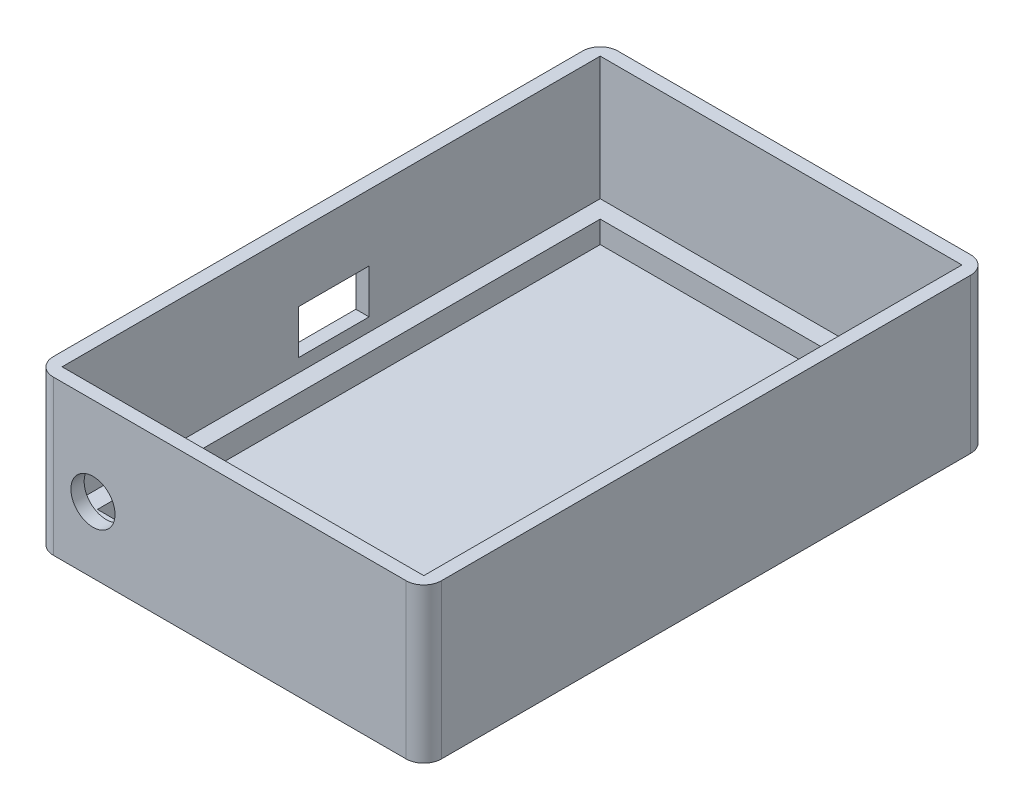
from build123d import *

# Parameters (mm, degrees)
SKETCH1_W           = 44
SKETCH1_H           = 64
SKETCH1_W_2         = 40
SKETCH1_H_2         = 60
SKETCH1_W_3         = 37
SKETCH1_H_3         = 57
BOSS_EXTRUDE1_DEPTH = 2.5
SKETCH2_W           = 44
SKETCH2_H           = 64
SKETCH2_W_2         = 41
SKETCH2_H_2         = 61
BOSS_EXTRUDE2_DEPTH = 14
SKETCH3_W           = 44
SKETCH3_H           = 64
BOSS_EXTRUDE3_DEPTH = 1
SKETCH4_W           = 8
SKETCH4_H           = 5
CUT_EXTRUDE1_DEPTH  = 8
SKETCH5_R           = 2.5
CUT_EXTRUDE2_DEPTH  = 8
FILLET1_R           = 2


with BuildPart() as part:
    # Sketch1 → Boss-Extrude1 (new body)
    # profile 1 of 2: a face of its own
    with BuildSketch(Plane(origin=(0, 0, 0), x_dir=(1, 0, 0), z_dir=(0, 1, 0))):
        Rectangle(SKETCH1_W, SKETCH1_H)
        Rectangle(SKETCH1_W_2, SKETCH1_H_2, mode=Mode.SUBTRACT)
    # profile 2 of 2: a face of its own
    with BuildSketch(Plane(origin=(0, 0, 0), x_dir=(1, 0, 0), z_dir=(0, 1, 0))):
        Rectangle(SKETCH1_W_2, SKETCH1_H_2)
        Rectangle(SKETCH1_W_3, SKETCH1_H_3, mode=Mode.SUBTRACT)
    extrude(amount=-BOSS_EXTRUDE1_DEPTH)

    # Sketch2 → Boss-Extrude2 (add)
    with BuildSketch(Plane(origin=(0, 0, 0), x_dir=(1, 0, 0), z_dir=(0, 1, 0))):
        Rectangle(SKETCH2_W, SKETCH2_H)
        Rectangle(SKETCH2_W_2, SKETCH2_H_2, mode=Mode.SUBTRACT)
    extrude(amount=BOSS_EXTRUDE2_DEPTH)

    # Sketch3 → Boss-Extrude3 (add)
    with BuildSketch(Plane.XZ.offset(2.5)):
        Rectangle(SKETCH3_W, SKETCH3_H)
    extrude(amount=BOSS_EXTRUDE3_DEPTH)

    # Sketch4 → Cut-Extrude1 (cut)
    with BuildSketch(Plane(origin=(-20.5, 0, 0), x_dir=(0, 0, -1), z_dir=(1, 0, 0))):
        with Locations((0.298083895, 4)):
            Rectangle(SKETCH4_W, SKETCH4_H)
    extrude(amount=-CUT_EXTRUDE1_DEPTH, mode=Mode.SUBTRACT)

    # Sketch5 → Cut-Extrude2 (cut)
    with BuildSketch(Plane(origin=(0, 0, 30.5), x_dir=(-1, 0, 0), z_dir=(0, 0, -1))):
        with Locations((15.5, 4)):
            Circle(SKETCH5_R)
    extrude(amount=-CUT_EXTRUDE2_DEPTH, mode=Mode.SUBTRACT)

    # Fillet1
    fillet1_edges = [part.edges().sort_by_distance(p)[0] for p in [
        (-22, 5.25, -32),
        (22, 5.25, -32),
        (22, 5.25, 32),
        (-22, 5.25, 32),
    ]]
    fillet(fillet1_edges, radius=FILLET1_R)


solid = part.part
